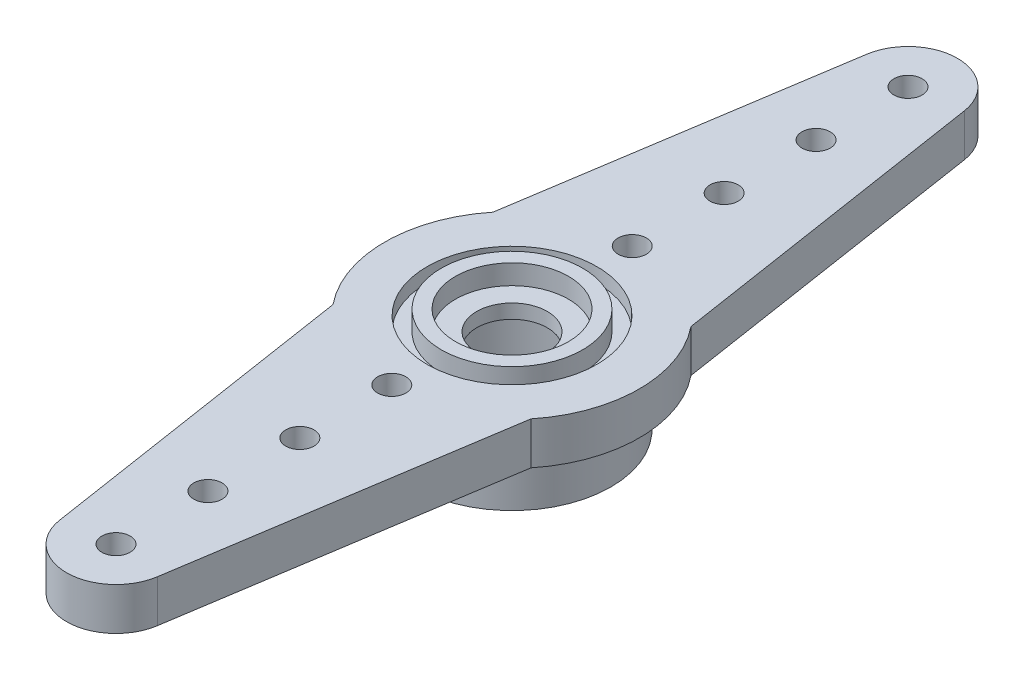
from build123d import *

# Parameters (mm, degrees)
SKETCH1_R                         = 4.5
BOSS_EXTRUDE1_DEPTH               = 1.5
BOSS_EXTRUDE2_DEPTH               = 1.5
F_1_0_1_DIAMETER_HOLE1_AT_2_COUNT = 2
F_1_0_1_DIAMETER_HOLE1_AT_2_PITCH = 3.25
F_1_0_1_DIAMETER_HOLE1_AT_3_COUNT = 2
F_1_0_1_DIAMETER_HOLE1_AT_3_PITCH = 6.5
F_1_0_1_DIAMETER_HOLE1_AT_4_COUNT = 2
F_1_0_1_DIAMETER_HOLE1_AT_4_PITCH = 9.75
CIRPATTERN1_COUNT                 = 2
SKETCH6_R                         = 3
CUT_EXTRUDE1_DEPTH                = 0.5
SKETCH7_R                         = 2.5
SKETCH7_R_2                       = 2
EXTRUDE_THIN1_DEPTH               = 0.7
SKETCH8_R                         = 1.25
CUT_EXTRUDE2_DEPTH                = 17.410743432
SKETCH9_R                         = 3.5
BOSS_EXTRUDE3_DEPTH               = 2
CUT_EXTRUDE3_START                = -2.5
SKETCH10_R                        = 3
CUT_EXTRUDE3_DEPTH                = 2.5


with BuildPart() as part:
    # Sketch1 → Boss-Extrude1 (new body)
    with BuildSketch(Plane(origin=(0, 0, 0), x_dir=(1, 0, 0), z_dir=(0, 1, 0))):
        with Locations(Location((0, 0, 0), (0, 0, 270))):
            Circle(SKETCH1_R)
    extrude(amount=BOSS_EXTRUDE1_DEPTH)

    # Sketch2 → Boss-Extrude2 (add)
    with BuildSketch(Plane(origin=(0, 0, 0), x_dir=(1, 0, 0), z_dir=(0, 1, 0))):
        with BuildLine():
            Line((3.5, 2.828427125), (1.729406446, 14.267681426))
            ThreePointArc((1.729406446, 14.267681426), (0, 15.75), (-1.729406446, 14.267681426))
            Line((-1.729406446, 14.267681426), (-3.5, 2.828427125))
            Line((-3.5, 2.828427125), (3.5, 2.828427125))
        make_face()
    boss_extrude2 = extrude(amount=BOSS_EXTRUDE2_DEPTH)

    # Sketch5 → Ø1.0 (1) Diameter Hole1 (revolve, cut)
    with BuildSketch(Plane(origin=(0, 1.5, -14), x_dir=(0, 0, 1), z_dir=(1, 0, 0))):
        Polygon((0, 0), (0, 7.80043031), (0.5, 7.5), (0.5, 0), align=None)
    f_1_0_1_diameter_hole1 = revolve(axis=Axis((0, 7.85, -14), (0, -1, 0)), mode=Mode.SUBTRACT)

    # Ø1.0 (1) Diameter Hole1 at 2: Ø1.0 (1) Diameter Hole1 ×2
    with Locations(*[(0, 0, i * F_1_0_1_DIAMETER_HOLE1_AT_2_PITCH) for i in range(1, F_1_0_1_DIAMETER_HOLE1_AT_2_COUNT)]):
        add(f_1_0_1_diameter_hole1, mode=Mode.SUBTRACT)

    # Ø1.0 (1) Diameter Hole1 at 3: Ø1.0 (1) Diameter Hole1 ×2
    with Locations(*[(0, 0, i * F_1_0_1_DIAMETER_HOLE1_AT_3_PITCH) for i in range(1, F_1_0_1_DIAMETER_HOLE1_AT_3_COUNT)]):
        add(f_1_0_1_diameter_hole1, mode=Mode.SUBTRACT)

    # Ø1.0 (1) Diameter Hole1 at 4: Ø1.0 (1) Diameter Hole1 ×2
    with Locations(*[(0, 0, i * F_1_0_1_DIAMETER_HOLE1_AT_4_PITCH) for i in range(1, F_1_0_1_DIAMETER_HOLE1_AT_4_COUNT)]):
        add(f_1_0_1_diameter_hole1, mode=Mode.SUBTRACT)

    # CirPattern1: Boss-Extrude2, Ø1.0 (1) Diameter Hole1 ×2 about axis
    cirpattern1_axis = Axis((0, 0, 0), (0, 1, 0))
    add([boss_extrude2.rotate(cirpattern1_axis, i * 360 / CIRPATTERN1_COUNT) for i in range(1, CIRPATTERN1_COUNT)])
    add([f_1_0_1_diameter_hole1.rotate(cirpattern1_axis, i * 360 / CIRPATTERN1_COUNT) for i in range(1, CIRPATTERN1_COUNT)], mode=Mode.SUBTRACT)

    # CirPattern1 copy 1 sketch → CirPattern1 copy 1 (revolve, cut)
    with BuildSketch(Plane(origin=(0, 1.5, 10.75), x_dir=(0, 0, -1), z_dir=(-1, 0, 0))):
        Polygon((0, 0), (0, 7.80043031), (0.5, 7.5), (0.5, 0), align=None)
    revolve(axis=Axis((0, 7.85, 10.75), (0, -1, 0)), mode=Mode.SUBTRACT)

    # CirPattern1 copy 2 sketch → CirPattern1 copy 2 (revolve, cut)
    with BuildSketch(Plane(origin=(0, 1.5, 7.5), x_dir=(0, 0, -1), z_dir=(-1, 0, 0))):
        Polygon((0, 0), (0, 7.80043031), (0.5, 7.5), (0.5, 0), align=None)
    revolve(axis=Axis((0, 7.85, 7.5), (0, -1, 0)), mode=Mode.SUBTRACT)

    # CirPattern1 copy 3 sketch → CirPattern1 copy 3 (revolve, cut)
    with BuildSketch(Plane(origin=(0, 1.5, 4.25), x_dir=(0, 0, -1), z_dir=(-1, 0, 0))):
        Polygon((0, 0), (0, 7.80043031), (0.5, 7.5), (0.5, 0), align=None)
    revolve(axis=Axis((0, 7.85, 4.25), (0, -1, 0)), mode=Mode.SUBTRACT)

    # Sketch6 → Cut-Extrude1 (cut)
    with BuildSketch(Plane(origin=(0, 1.5, 0), x_dir=(1, 0, 0), z_dir=(0, 1, 0))):
        with Locations(Location((0, 0, 0), (0, 0, 270))):
            Circle(SKETCH6_R)
    extrude(amount=-CUT_EXTRUDE1_DEPTH, mode=Mode.SUBTRACT)

    # Sketch7 → Extrude-Thin1 (add)
    with BuildSketch(Plane(origin=(0, 1, 0), x_dir=(1, 0, 0), z_dir=(0, 1, 0))):
        Circle(SKETCH7_R)
        Circle(SKETCH7_R_2, mode=Mode.SUBTRACT)
    extrude(amount=EXTRUDE_THIN1_DEPTH)

    # Sketch8 → Cut-Extrude2 (cut, through all)
    with BuildSketch(Plane(origin=(0, 1, 0), x_dir=(1, 0, 0), z_dir=(0, 1, 0))):
        with Locations(Location((0, 0, 0), (0, 0, 270))):
            Circle(SKETCH8_R)
    extrude(amount=-CUT_EXTRUDE2_DEPTH, mode=Mode.SUBTRACT)

    # Sketch9 → Boss-Extrude3 (add)
    with BuildSketch(Plane.XZ):
        with Locations(Location((0, 0, 0), (0, 0, 90))):
            Circle(SKETCH9_R)
    extrude(amount=BOSS_EXTRUDE3_DEPTH)

    # Sketch10 → Cut-Extrude3 (cut)
    with BuildSketch(Plane.XZ.offset(2).offset(CUT_EXTRUDE3_START)):
        with Locations(Location((0, 0, 0), (0, 0, 90))):
            Circle(SKETCH10_R)
    extrude(amount=CUT_EXTRUDE3_DEPTH, mode=Mode.SUBTRACT)


solid = part.part
